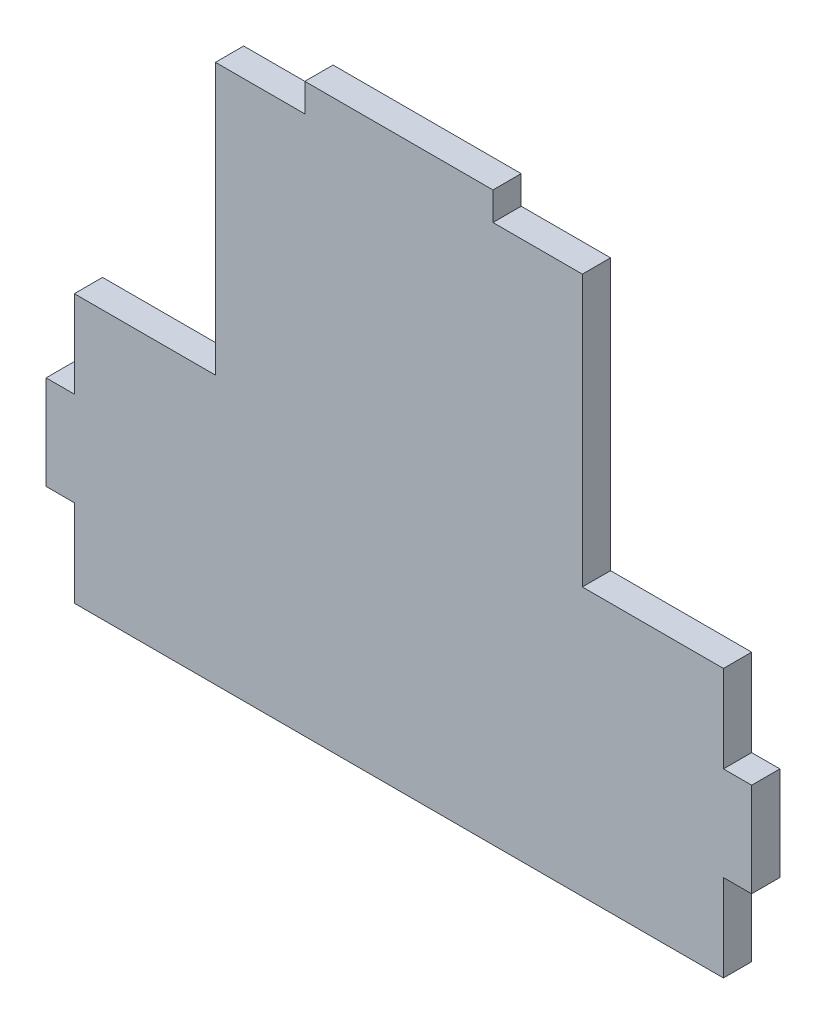
from build123d import *

# Parameters (mm, degrees)
SALIENTE_EXTRUIR1_DEPTH = 3
CROQUIS2_W              = 3
CROQUIS2_H              = 10
CROQUIS2_W_2            = 20
CROQUIS2_H_2            = 3
SALIENTE_EXTRUIR2_DEPTH = 3


with BuildPart() as part:
    # Croquis1 → Saliente-Extruir1 (new body)
    with BuildSketch(Plane.XY):
        Polygon((18, -3), (57, -3), (57, -31.8), (72, -31.8), (72, -60.3), (3, -60.3), (3, -31.8), (18, -31.8), align=None)
    extrude(amount=SALIENTE_EXTRUIR1_DEPTH)

    # Croquis2 → Saliente-Extruir2 (add)
    with BuildSketch(Plane.XY.offset(3)):
        with Locations((73.5, -46.05)):
            Rectangle(CROQUIS2_W, CROQUIS2_H)
        with Locations((1.5, -46.05)):
            Rectangle(CROQUIS2_W, CROQUIS2_H)
        with Locations((37.5, -1.5)):
            Rectangle(CROQUIS2_W_2, CROQUIS2_H_2)
    extrude(amount=-SALIENTE_EXTRUIR2_DEPTH)


solid = part.part
